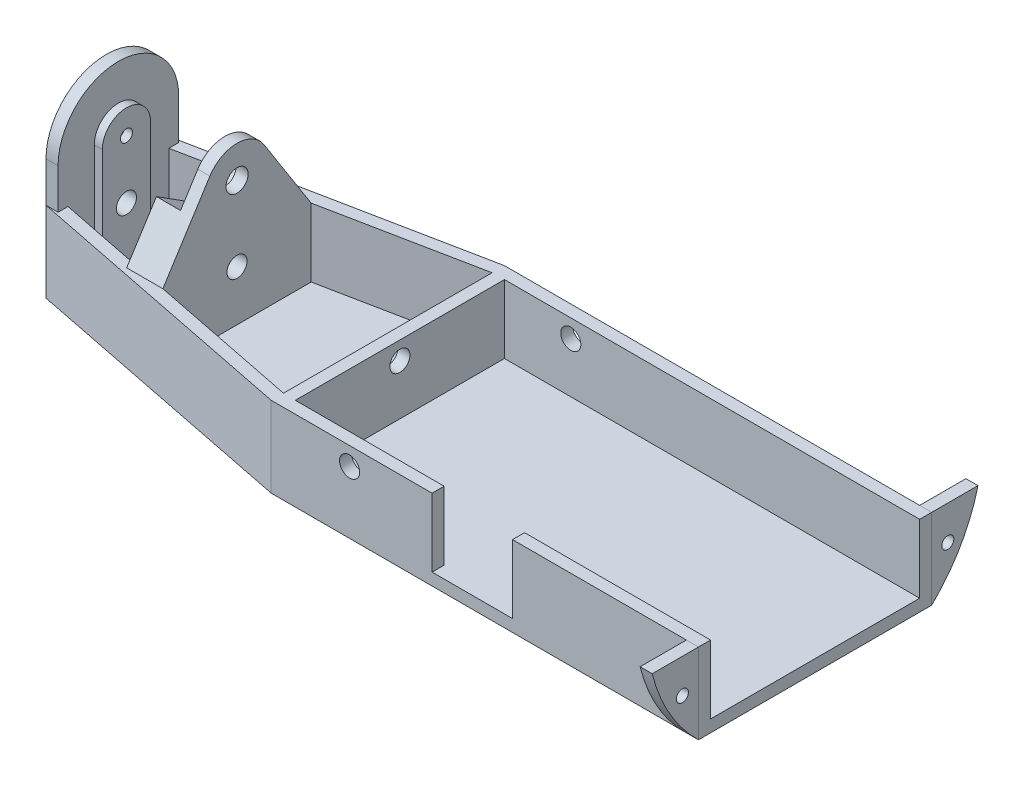
from build123d import *

# Parameters (mm, degrees)
SKETCH2_W               = 106.25
SKETCH2_H               = 58
BOSS_EXTRUDE1_DEPTH     = 3
SKETCH3_W               = 103.25
SKETCH3_H               = 3
BOSS_EXTRUDE2_DEPTH     = 20
SKETCH4_W               = 3
SKETCH4_H               = 30
BOSS_EXTRUDE3_DEPTH     = 30
BOSS_EXTRUDE4_DEPTH     = 17
SKETCH6_R               = 15
BOSS_EXTRUDE5_DEPTH     = 3
CUT_EXTRUDE1_REACH      = 186.201
SKETCH7_R               = 3.1
SKETCH19_R              = 1.5
BOSS_EXTRUDE9_DEPTH     = 2
BOSS_EXTRUDE6_DEPTH     = 17
SKETCH9_R               = 2.5
CUT_EXTRUDE2_DEPTH      = 185.201146848
CUT_EXTRUDE3_DEPTH      = 141.034147621
CUT_EXTRUDE3_DEPTH_BACK = 141.034147621
SKETCH10_R              = 2.5
SKETCH14_R              = 2.75
BOSS_EXTRUDE7_DEPTH     = 9
SKETCH16_R              = 1.5
BOSS_EXTRUDE8_DEPTH     = 3
BOSS_EXTRUDE8_2_DEPTH   = 3
CUT_EXTRUDE4_START      = -6
CUT_EXTRUDE4_DEPTH      = 6
SKETCH18_W              = 20
SKETCH18_H              = 17
CUT_EXTRUDE5_DEPTH      = 3


with BuildPart() as part:
    # Sketch2 → Boss-Extrude1 (new body)
    with BuildSketch(Plane(origin=(0, 0, 0), x_dir=(1, 0, 0), z_dir=(0, 1, 0))):
        Polygon((-119.25, 15), (-49.25, 29), (-49.25, -29), (-119.25, -15), align=None)
        with Locations((3.875, 0)):
            Rectangle(SKETCH2_W, SKETCH2_H)
    extrude(amount=BOSS_EXTRUDE1_DEPTH)

    # Sketch3 → Boss-Extrude2 (add)
    with BuildSketch(Plane.XZ):
        with Locations((5.375, 27.5)):
            Rectangle(SKETCH3_W, SKETCH3_H)
        Polygon((-46.25, 29), (-49.25, 29), (-49.25, 25.940588292), (-49.25, -25.940588292), (-49.25, -29), (-46.25, -29), (-46.25, -26), (-46.25, 26), align=None)
        with Locations((5.375, -27.5)):
            Rectangle(SKETCH3_W, SKETCH3_H)
    extrude(amount=-BOSS_EXTRUDE2_DEPTH)

    # Sketch4 → Boss-Extrude3 (add)
    with BuildSketch(Plane.XZ):
        with Locations((-117.75, 0)):
            Rectangle(SKETCH4_W, SKETCH4_H)
    extrude(amount=-BOSS_EXTRUDE3_DEPTH)

    # Sketch5 → Boss-Extrude4 (add)
    with BuildSketch(Plane(origin=(0, 3, 0), x_dir=(1, 0, 0), z_dir=(0, 1, 0))):
        Polygon((-49.25, 25.940588292), (-116.25, 12.540588292), (-119.25, 15), (-49.25, 29), align=None)
        Polygon((-49.25, -25.940588292), (-116.25, -12.540588292), (-119.25, -15), (-49.25, -29), align=None)
    extrude(amount=BOSS_EXTRUDE4_DEPTH)

    # Sketch6 → Boss-Extrude5 (add)
    with BuildSketch(Plane.ZY.offset(119.25)):
        with Locations((0, 30)):
            Circle(SKETCH6_R)
    extrude(amount=-BOSS_EXTRUDE5_DEPTH)

    # Sketch7 → Cut-Extrude1 (cut, up to next)
    with BuildSketch(Plane.ZY.offset(119.25), mode=Mode.PRIVATE) as cut_extrude1_sk1:
        with Locations((0, 30)):
            Circle(SKETCH7_R)
    cut_extrude1_tool1 = extrude(cut_extrude1_sk1.sketch, amount=-CUT_EXTRUDE1_REACH, mode=Mode.PRIVATE) & part.part
    add(cut_extrude1_tool1.solids().sort_by_distance((-119.25, 30, 0))[0], mode=Mode.SUBTRACT)

    # Sketch19 → Boss-Extrude9 (add)
    with BuildSketch(Plane(origin=(-116.25, 0, 0), x_dir=(0, 0, -1), z_dir=(1, 0, 0))):
        with BuildLine():
            Line((-6, 30), (-6, 0.329020031))
            Line((-6, 0.329020031), (6, 0.329020031))
            Line((6, 0.329020031), (6, 30))
            ThreePointArc((6, 30), (0, 36), (-6, 30))
        make_face()
        with Locations((0, 30)):
            Circle(SKETCH19_R, mode=Mode.SUBTRACT)
    extrude(amount=BOSS_EXTRUDE9_DEPTH)

    # Sketch11 → Boss-Extrude6 (add)
    with BuildSketch(Plane(origin=(0, 3, 0), x_dir=(1, 0, 0), z_dir=(0, 1, 0))):
        Polygon((-86.75, 18.440588292), (-86.75, -18.440588292), (-95.75, -16.640588292), (-95.75, 16.640588292), align=None)
    extrude(amount=BOSS_EXTRUDE6_DEPTH)

    # Sketch9 → Cut-Extrude2 (cut, through all)
    with BuildSketch(Plane.ZY.offset(119.25)):
        with Locations((0, 15.5)):
            Circle(SKETCH9_R)
    extrude(amount=-CUT_EXTRUDE2_DEPTH, mode=Mode.SUBTRACT)

    # Sketch10 → Cut-Extrude3 (cut, two sides: drawn at the far end of the back side and taken through both)
    with BuildSketch(Plane.XY.offset(29).offset(-CUT_EXTRUDE3_DEPTH_BACK)):
        with Locations((-29.75, 15.5)):
            Circle(SKETCH10_R)
    extrude(amount=CUT_EXTRUDE3_DEPTH + CUT_EXTRUDE3_DEPTH_BACK, mode=Mode.SUBTRACT)

    # Sketch14 → Boss-Extrude7 (add)
    with BuildSketch(Plane(origin=(-86.75, 0, 0), x_dir=(0, 0, -1), z_dir=(1, 0, 0))):
        with BuildLine():
            Line((18.440588292, 20), (6.751720823, 38.391184677))
            ThreePointArc((6.751720823, 38.391184677), (0, 42.1), (-6.751720823, 38.391184677))
            Line((-6.751720823, 38.391184677), (-18.440588292, 20))
            Line((-18.440588292, 20), (18.440588292, 20))
        make_face()
        with Locations((0, 34.1)):
            Circle(SKETCH14_R, mode=Mode.SUBTRACT)
    extrude(amount=-BOSS_EXTRUDE7_DEPTH)

    # Sketch17 → Cut-Extrude4 (cut)
    with BuildSketch(Plane.ZY.offset(95.75).offset(CUT_EXTRUDE4_START)):
        with BuildLine():
            Line((4.291184677, 27.348279177), (11.0429055, 31.639463855))
            Line((11.0429055, 31.639463855), (6.751720823, 38.391184677))
            ThreePointArc((6.751720823, 38.391184677), (0, 42.1), (-6.751720823, 38.391184677))
            Line((-6.751720823, 38.391184677), (-11.0429055, 31.639463855))
            Line((-11.0429055, 31.639463855), (-4.291184677, 27.348279177))
            ThreePointArc((-4.291184677, 27.348279177), (0, 26.1), (4.291184677, 27.348279177))
        make_face()
    extrude(amount=CUT_EXTRUDE4_DEPTH, mode=Mode.SUBTRACT)

    # Sketch18 → Cut-Extrude5 (cut)
    with BuildSketch(Plane.XY.offset(29)):
        with Locations((0.75, 11.5)):
            Rectangle(SKETCH18_W, SKETCH18_H)
    extrude(amount=-CUT_EXTRUDE5_DEPTH, mode=Mode.SUBTRACT)


with BuildPart() as body_2:
    # Sketch16 → Boss-Extrude8 (new body)
    with BuildSketch(Plane(origin=(57, 0, 0), x_dir=(0, 0, -1), z_dir=(1, 0, 0))):
        with BuildLine():
            Line((-29, 20), (-40.509258201, 20))
            ThreePointArc((-40.509258201, 20), (-36.164682273, 9.188566698), (-29, 0))
            Line((-29, 0), (-29, 20))
        make_face()
        with Locations((-33, 11.5)):
            Circle(SKETCH16_R, mode=Mode.SUBTRACT)
    extrude(amount=-BOSS_EXTRUDE8_DEPTH)


with BuildPart() as body_3:
    # Sketch16 → Boss-Extrude8 2 (new body)
    with BuildSketch(Plane(origin=(57, 0, 0), x_dir=(0, 0, -1), z_dir=(1, 0, 0))):
        with BuildLine():
            Line((29, 20), (40.509258201, 20))
            ThreePointArc((40.509258201, 20), (36.164682273, 9.188566698), (29, 0))
            Line((29, 0), (29, 20))
        make_face()
        with Locations((33, 11.5)):
            Circle(SKETCH16_R, mode=Mode.SUBTRACT)
    extrude(amount=-BOSS_EXTRUDE8_2_DEPTH)


solid = Compound([part.part, body_2.part, body_3.part])
